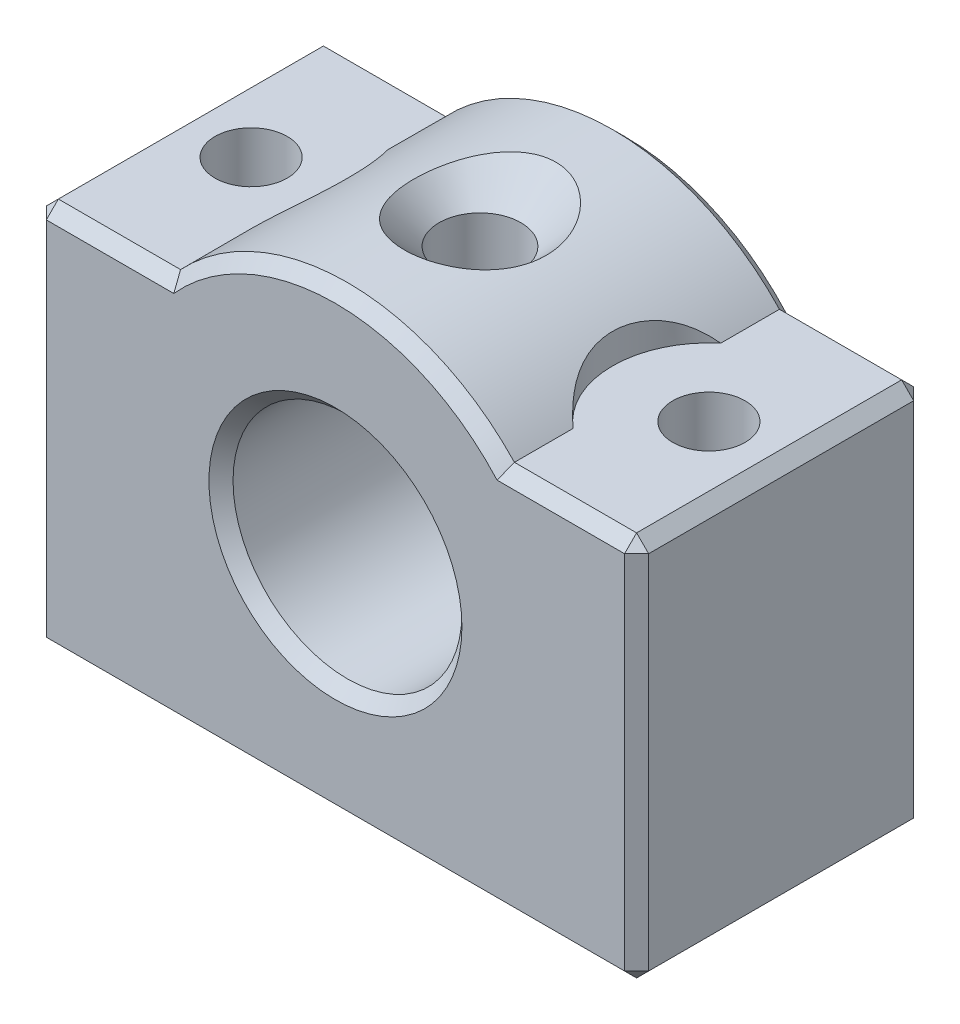
from build123d import *

# Parameters (mm, degrees)
SKETCH1_R                                       = 4.75
BOSS_EXTRUDE1_DEPTH                             = 6
CUT_EXTRUDE1_REACH                              = 23.172
SKETCH2_R                                       = 1.5
CUT_EXTRUDE2_DEPTH                              = 3
CSK_FOR_M3_FLAT_HEAD_MACHINE_SCREW1_D           = 3.4
CSK_FOR_M3_FLAT_HEAD_MACHINE_SCREW1_DEPTH       = 9
CSK_FOR_M3_FLAT_HEAD_MACHINE_SCREW1_CSINK_D     = 6.3
CSK_FOR_M3_FLAT_HEAD_MACHINE_SCREW1_CSINK_ANGLE = 90
CSK_FOR_M3_FLAT_HEAD_MACHINE_SCREW1_TIP         = 1.021463052
CHAMFER1_SIZE                                   = 0.5


with BuildPart() as part:
    # Sketch1 → Boss-Extrude1 (new, symmetric)
    with BuildSketch(Plane.XY):
        with BuildLine():
            Line((6.92820323, 16), (12.5, 16))
            Line((12.5, 16), (12.5, 0))
            Line((12.5, 0), (-12.5, 0))
            Line((-12.5, 0), (-12.5, 16))
            Line((-12.5, 16), (-6.92820323, 16))
            ThreePointArc((-6.92820323, 16), (0, 19), (6.92820323, 16))
        make_face()
        with Locations((0, 9.5)):
            Circle(SKETCH1_R, mode=Mode.SUBTRACT)
    extrude(amount=BOSS_EXTRUDE1_DEPTH, both=True)

    # Sketch2 → Cut-Extrude1 (cut, up to next)
    with BuildSketch(Plane(origin=(0, 16, 0), x_dir=(1, 0, 0), z_dir=(0, 1, 0)), mode=Mode.PRIVATE) as cut_extrude1_sk1:
        with Locations(Location((-9.5, 0, 0), (0, 0, 270))):
            Circle(SKETCH2_R)
    cut_extrude1_tool1 = extrude(cut_extrude1_sk1.sketch, amount=-CUT_EXTRUDE1_REACH, mode=Mode.PRIVATE) & part.part
    # Sketch2 → Cut-Extrude1 (cut, up to next)
    with BuildSketch(Plane(origin=(0, 16, 0), x_dir=(1, 0, 0), z_dir=(0, 1, 0)), mode=Mode.PRIVATE) as cut_extrude1_sk2:
        with Locations(Location((9.5, 0, 0), (0, 0, 270))):
            Circle(SKETCH2_R)
    cut_extrude1_tool2 = extrude(cut_extrude1_sk2.sketch, amount=-CUT_EXTRUDE1_REACH, mode=Mode.PRIVATE) & part.part
    add(cut_extrude1_tool1.solids().sort_by_distance((-9.5, 16, 0))[0], mode=Mode.SUBTRACT)
    add(cut_extrude1_tool2.solids().sort_by_distance((9.5, 16, 0))[0], mode=Mode.SUBTRACT)

    # Sketch3 → Cut-Extrude2 (cut)
    with BuildSketch(Plane(origin=(0, 16, 0), x_dir=(1, 0, 0), z_dir=(0, 1, 0))):
        with BuildLine():
            Line((6.92820323, -3.06363532), (6.92820323, 3.06363532))
            ThreePointArc((6.92820323, 3.06363532), (5.5, 0), (6.92820323, -3.06363532))
        make_face()
        with BuildLine():
            Line((-6.92820323, -3.06363532), (-6.92820323, 3.06363532))
            ThreePointArc((-6.92820323, 3.06363532), (-5.5, 0), (-6.92820323, -3.06363532))
        make_face()
    extrude(amount=CUT_EXTRUDE2_DEPTH, mode=Mode.SUBTRACT)

    # CSK for M3 Flat Head Machine Screw1
    with Locations(Plane(origin=(0, 19, 0), x_dir=(1, 0, 0), z_dir=(0, 1, 0))):
        with Locations((0, 0)):
            CounterSinkHole(CSK_FOR_M3_FLAT_HEAD_MACHINE_SCREW1_D / 2, CSK_FOR_M3_FLAT_HEAD_MACHINE_SCREW1_CSINK_D / 2, depth=CSK_FOR_M3_FLAT_HEAD_MACHINE_SCREW1_DEPTH, counter_sink_angle=CSK_FOR_M3_FLAT_HEAD_MACHINE_SCREW1_CSINK_ANGLE)
            with Locations((0, 0, -(CSK_FOR_M3_FLAT_HEAD_MACHINE_SCREW1_DEPTH + CSK_FOR_M3_FLAT_HEAD_MACHINE_SCREW1_TIP / 2))):  # 118° drill point
                Cone(0, CSK_FOR_M3_FLAT_HEAD_MACHINE_SCREW1_D / 2, CSK_FOR_M3_FLAT_HEAD_MACHINE_SCREW1_TIP, mode=Mode.SUBTRACT)

    # Chamfer1
    chamfer1_edges = [part.edges().sort_by_distance(p)[0] for p in [
        (12.5, 0, 0),
        (-12.5, 0, 0),
        (-12.5, 16, 0),
        (12.5, 16, 0),
        (0, 19, 6),
        (-9.714101615, 16, 6),
        (-4.75, 9.5, -6),
        (-4.75, 9.5, 6),
        (-12.5, 8, 6),
        (0, 0, 6),
        (12.5, 8, 6),
        (0, 0, -6),
        (-12.5, 8, -6),
        (-9.714101615, 16, -6),
        (0, 19, -6),
        (9.714101615, 16, -6),
        (12.5, 8, -6),
        (9.714101615, 16, 6),
    ]]
    chamfer(chamfer1_edges, length=CHAMFER1_SIZE)


solid = part.part
